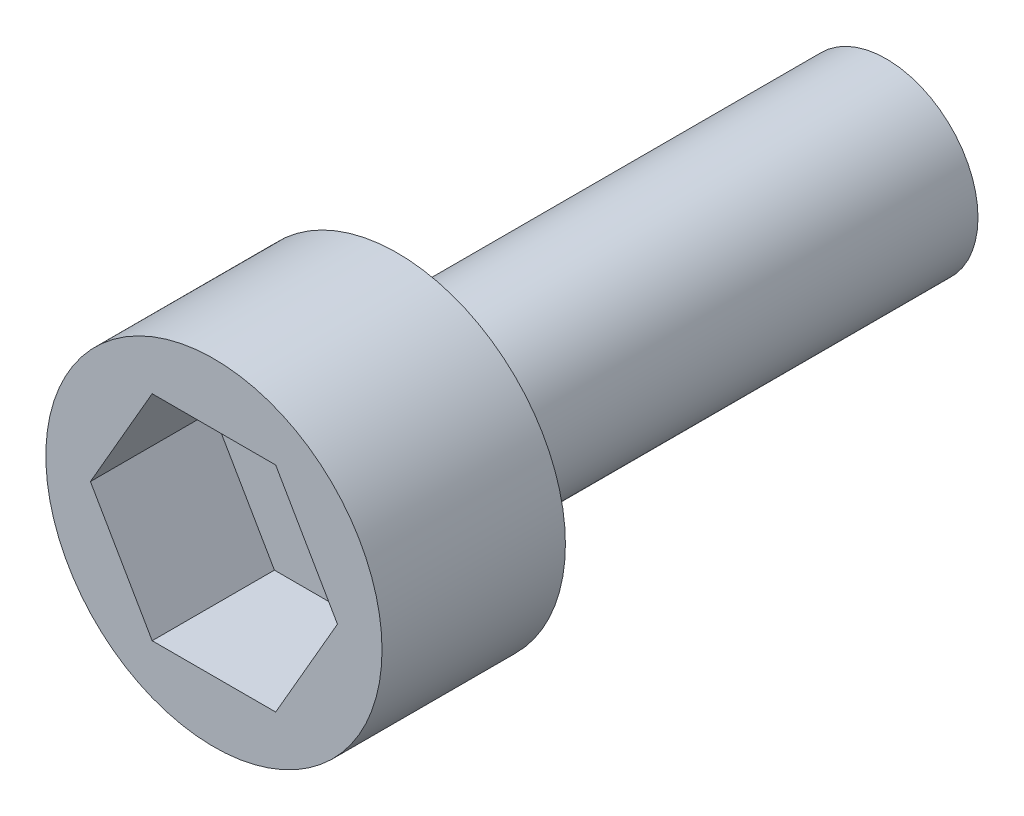
from build123d import *

# Parameters (mm, degrees)
ESQUISSE1_R             = 1.5
BOSS_EXTRU_1_DEPTH      = 8
ESQUISSE2_R             = 2.75
BOSS_EXTRU_2_DEPTH      = 3
ENL_V_MAT_EXTRU_1_DEPTH = 2


with BuildPart() as part:
    # Esquisse1 → Boss.-Extru.1 (new body)
    with BuildSketch(Plane.XY):
        Circle(ESQUISSE1_R)
    extrude(amount=BOSS_EXTRU_1_DEPTH)

    # Esquisse2 → Boss.-Extru.2 (add)
    with BuildSketch(Plane.XY.offset(8)):
        Circle(ESQUISSE2_R)
    extrude(amount=BOSS_EXTRU_2_DEPTH)

    # Esquisse3 → Enlèv. mat.-Extru.1 (cut)
    with BuildSketch(Plane.XY.offset(11)):
        Polygon((2.020725942, 0), (1.010362971, 1.75), (-1.010362971, 1.75), (-2.020725942, 0), (-1.010362971, -1.75), (1.010362971, -1.75), align=None)
    extrude(amount=-ENL_V_MAT_EXTRU_1_DEPTH, mode=Mode.SUBTRACT)


solid = part.part
